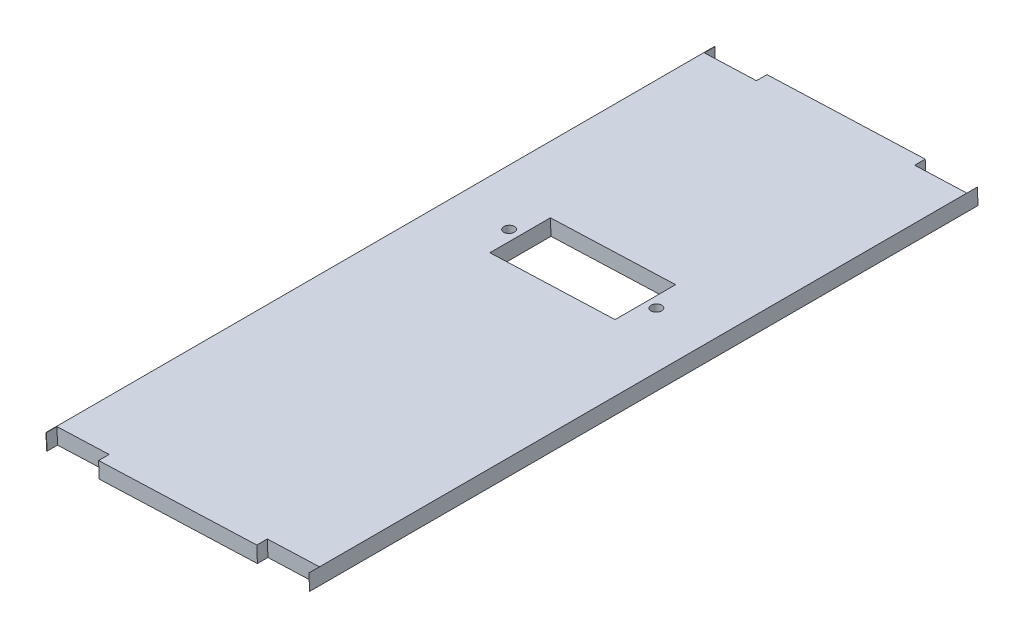
from build123d import *

# Parameters (mm, degrees)
EXTRUDE_1_DEPTH     = 127
SKETCH_3_W          = 9.917998233
SKETCH_3_H          = 2
CUT_EXTRUDE_1_DEPTH = 890.48684692
SKETCH_4_R          = 1
SKETCH_4_W          = 23.8
SKETCH_4_H          = 11.5
CUT_EXTRUDE_2_DEPTH = 890.48684692


with BuildPart() as part:
    # 草图2 → 凸台-拉伸1 (new body)
    with BuildSketch(Plane(origin=(0, 0, 762.01), x_dir=(-1, 0, 0), z_dir=(0, 0, -1))):
        Polygon((-21.370258024, -5.639890041), (28.594871448, -7.506929626), (28.475974915, -10.504572636), (-21.489154557, -8.637533051), align=None)
    extrude(amount=-EXTRUDE_1_DEPTH)

    # 草图3 → 切除-拉伸1 (cut, through all)
    with BuildSketch(Plane(origin=(0.240248379, -6.429451979, 0), x_dir=(0.9993025894470269, 0.03734079169577059, 0), z_dir=(-0.03734079169577059, 0.9993025894470269, 0))):
        with Locations((-23.814242896, -763.01)):
            Rectangle(SKETCH_3_W, SKETCH_3_H)
        with Locations((16.185757105, -763.01)):
            Rectangle(SKETCH_3_W, SKETCH_3_H)
        with Locations((-23.814242896, -888.01)):
            Rectangle(SKETCH_3_W, SKETCH_3_H)
        with Locations((16.185757105, -888.01)):
            Rectangle(SKETCH_3_W, SKETCH_3_H)
    extrude(amount=-CUT_EXTRUDE_1_DEPTH, mode=Mode.SUBTRACT)

    # 草图4 → 切除-拉伸2 (cut, through all)
    with BuildSketch(Plane(origin=(0.240248379, -6.429451979, 0), x_dir=(0.9993025894470269, 0.03734079169577059, 0), z_dir=(-0.03734079169577059, 0.9993025894470269, 0))):
        with Locations(Location((10.144756221, -812.01, 0), (0, 0, 180))):
            Circle(SKETCH_4_R)
        with Locations((-17.855243779, -812.01)):
            Circle(SKETCH_4_R)
        with Locations((-3.855243779, -812.01)):
            Rectangle(SKETCH_4_W, SKETCH_4_H)
    extrude(amount=-CUT_EXTRUDE_2_DEPTH, mode=Mode.SUBTRACT)


solid = part.part
